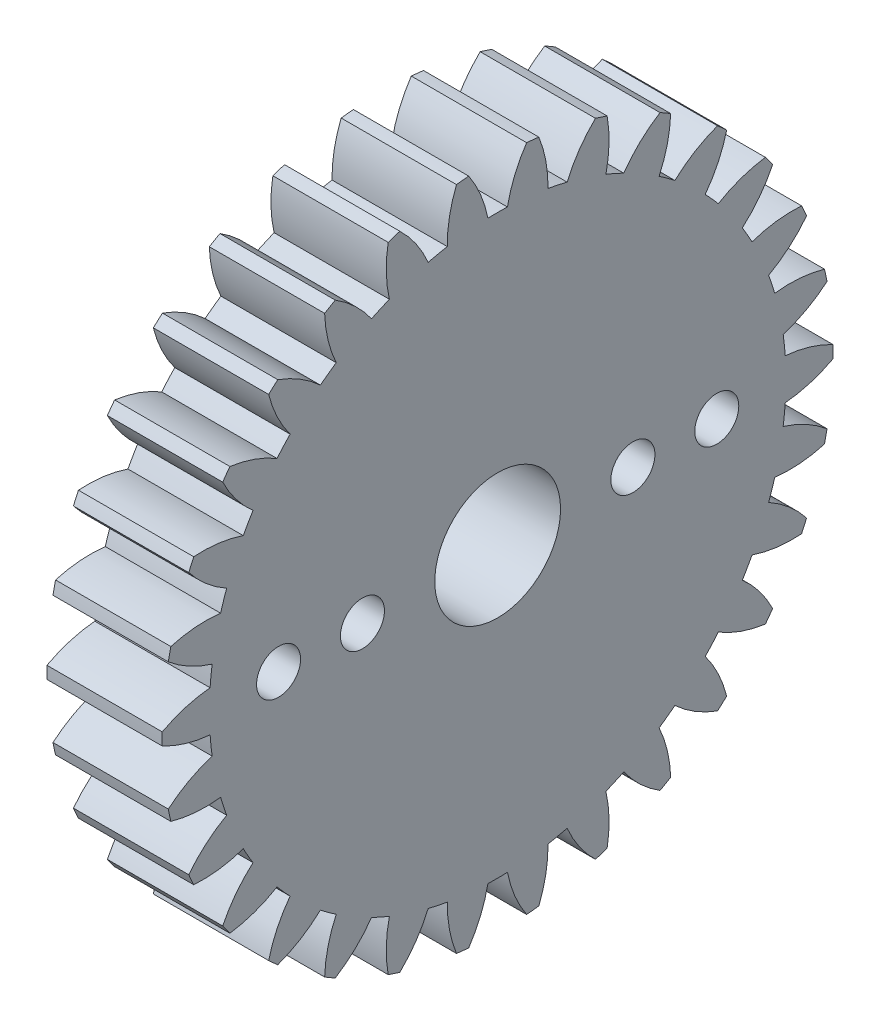
from build123d import *

# Parameters (mm, degrees)
BASPROSKE_W         = 5.5
BASPROSKE_H         = 16
TOOTHCUT_DEPTH      = 24.286262044
TEETHCUTS_COUNT     = 30
TEETHCUTS_ANGLE     = 348
BORSKE_R            = 0.5
BORE_DEPTH          = 50.0000508
SKETCH_1_R          = 3
SKETCH_1_R_2        = 1.05
CUT_EXTRUDE_1_DEPTH = 24.245268194


with BuildPart() as part:
    # BasProSke → Base-Revolve (revolve)
    with BuildSketch(Plane(origin=(0, 0, 0), x_dir=(1, 0, 0), z_dir=(0, 1, 0)), mode=Mode.PRIVATE) as base_revolve_sk:
        with Locations((2.75, 8)):
            Rectangle(BASPROSKE_W, BASPROSKE_H)
    revolve(base_revolve_sk.sketch.rotate(Axis((-10, 0, 0), (1, 0, 0)), 180), axis=Axis((-10, 0, 0), (1, 0, 0)))

    # TooCutSke → ToothCut (cut, through all)
    with BuildSketch(Plane(origin=(0, 0, 0), x_dir=(0, 0, -1), z_dir=(1, 0, 0))):
        with BuildLine():
            ThreePointArc((0.466400716, 13.741086979), (0, 13.749), (-0.466400716, 13.741086979))
            ThreePointArc((-0.466400716, 13.741086979), (-0.819142092, 14.899954875), (-1.3974676, 15.964351834))
            ThreePointArc((-1.3974676, 15.964351834), (0, 16.0254), (1.3974676, 15.964351834))
            ThreePointArc((1.3974676, 15.964351834), (0.819142092, 14.899954875), (0.466400716, 13.741086979))
        make_face()
    toothcut = extrude(amount=TOOTHCUT_DEPTH, mode=Mode.SUBTRACT)

    # TeethCuts: ToothCut ×30 about axis
    teethcuts_axis = Axis((-10, 0, 0), (1, 0, 0))
    for i in range(1, TEETHCUTS_COUNT):
        add(toothcut.rotate(teethcuts_axis, i * TEETHCUTS_ANGLE / (TEETHCUTS_COUNT - 1)), mode=Mode.SUBTRACT)

    # BorSke → Bore (cut, symmetric)
    with BuildSketch(Plane(origin=(0, 0, 0), x_dir=(0, 0, -1), z_dir=(1, 0, 0))):
        with Locations(Location((0, 0, 0), (0, 0, 180))):
            Circle(BORSKE_R)
    extrude(amount=BORE_DEPTH, both=True, mode=Mode.SUBTRACT)

    # ｽｹｯﾁ1 → ｶｯﾄ - 押し出し1 (cut, through all)
    with BuildSketch(Plane(origin=(5.5, 0, 0), x_dir=(0, 0, -1), z_dir=(1, 0, 0))):
        Circle(SKETCH_1_R)
        with Locations((6.45, 0)):
            Circle(SKETCH_1_R_2)
        with Locations((10.45, 0)):
            Circle(SKETCH_1_R_2)
        with Locations((-6.45, 0)):
            Circle(SKETCH_1_R_2)
        with Locations((-10.45, 0)):
            Circle(SKETCH_1_R_2)
    extrude(amount=-CUT_EXTRUDE_1_DEPTH, mode=Mode.SUBTRACT)


solid = part.part
